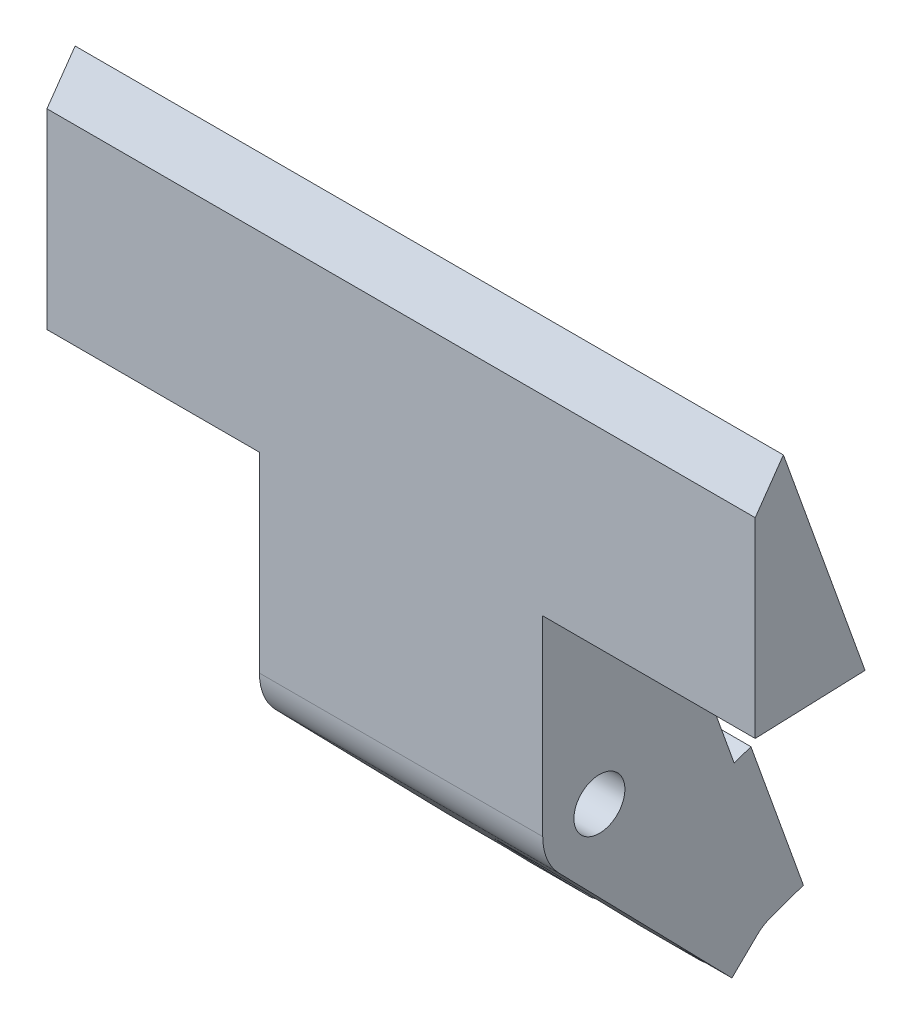
from build123d import *

# Parameters (mm, degrees)
BOSS_EXTRUDE1_DEPTH = 50.8
SCALE1_SCALE        = 0.5
SKETCH2_R           = 1.3462
CUT_EXTRUDE1_DEPTH  = 57.620860656
SKETCH3_R           = 2.286
CUT_EXTRUDE2_DEPTH  = 57.620860656
CUT_EXTRUDE3_DEPTH  = 2.286
CUT_EXTRUDE4_DEPTH  = 57.620860656
BOSS_EXTRUDE2_DEPTH = 31.75
SKETCH7_R           = 1.3462
CUT_EXTRUDE5_DEPTH  = 5.08


with BuildPart() as part:
    # Sketch1 → Boss-Extrude1 (new body)
    with BuildSketch(Plane(origin=(-34.925, 0, 0), x_dir=(0, 0, -1), z_dir=(1, 0, 0))):
        with BuildLine():
            Line((38.721808668, -36.878639896), (-2.875579258, 78.983230962))
            Line((-2.875579258, 78.983230962), (-10.16, 68.58))
            Line((-10.16, 68.58), (-10.16, 0))
            ThreePointArc((-10.16, 0), (-9.410554147, -3.829761173), (-7.27278137, -7.094522616))
            Line((-7.27278137, -7.094522616), (28.19983171, -43.458429465))
            ThreePointArc((28.19983171, -43.458429465), (36.112120939, -44.408324587), (38.721808668, -36.878639896))
        make_face()
    extrude(amount=-BOSS_EXTRUDE1_DEPTH)


with BuildPart() as part_1:
    # Scale1: scaled about (-60.325, 10.229435701, -8.69743621)
    add(part.part.scale(SCALE1_SCALE).moved(Location((-30.1625, 5.11471785, -4.348718105))))

    # Sketch2 → Cut-Extrude1 (cut, through all)
    with BuildSketch(Plane(origin=(-47.625, 0, 0), x_dir=(0, 0, -1), z_dir=(1, 0, 0))):
        with Locations((20.721378138, -14.397458564)):
            Circle(SKETCH2_R)
    extrude(amount=-CUT_EXTRUDE1_DEPTH, mode=Mode.SUBTRACT)

    # Sketch3 → Cut-Extrude2 (cut, through all)
    with BuildSketch(Plane(origin=(-47.625, 0, 0), x_dir=(0, 0, -1), z_dir=(1, 0, 0))):
        with Locations((4.348718105, 5.11471785)):
            Circle(SKETCH3_R)
    extrude(amount=-CUT_EXTRUDE2_DEPTH, mode=Mode.SUBTRACT)

    # Sketch4 → Cut-Extrude3 (cut, symmetric)
    with BuildSketch(Plane(origin=(-60.325, 0, 0), x_dir=(0, 0, -1), z_dir=(1, 0, 0))):
        with BuildLine():
            Line((9.58048069, -7.52352017), (18.44863396, -16.614496882))
            ThreePointArc((18.44863396, -16.614496882), (22.404778575, -17.089444443), (23.709622439, -13.324602098))
            Line((23.709622439, -13.324602098), (18.502250725, 1.179573745))
            Line((18.502250725, 1.179573745), (9.58048069, -7.52352017))
        make_face()
    extrude(amount=CUT_EXTRUDE3_DEPTH, both=True, mode=Mode.SUBTRACT)

    # Sketch5 → Cut-Extrude4 (cut, through all)
    with BuildSketch(Plane(origin=(-47.625, 0, 0), x_dir=(0, 0, -1), z_dir=(1, 0, 0))):
        Polygon((1.795924155, 43.013942134), (16.43679686, 2.234484886), (17.930919011, 2.770913119), (2.910928476, 44.606333332), align=None)
    extrude(amount=-CUT_EXTRUDE4_DEPTH, mode=Mode.SUBTRACT)

    # Sketch6 → Boss-Extrude2 (add, symmetric)
    with BuildSketch(Plane(origin=(-60.325, 0, 0), x_dir=(0, 0, -1), z_dir=(1, 0, 0))):
        Polygon((-0.731281895, 22.25971785), (-0.731281895, 39.40471785), (1.795924155, 43.013942134), (9.116360508, 22.62421351), align=None)
    extrude(amount=BOSS_EXTRUDE2_DEPTH, both=True)

    # Sketch7 → Cut-Extrude5 (cut)
    # profile 1 of 3: a face of its own
    with BuildSketch(Plane(origin=(-47.625, 0, 0), x_dir=(0, 0, -1), z_dir=(1, 0, 0))):
        with BuildLine():
            ThreePointArc((23.709622439, -13.324602098), (22.075761864, -11.525826672), (19.648521671, -11.409214263))
            ThreePointArc((19.648521671, -11.409214263), (19.037977702, -11.705472686), (18.504339821, -12.124714386))
            ThreePointArc((18.504339821, -12.124714386), (17.546622489, -14.358068573), (18.44863396, -16.614496882))
            ThreePointArc((18.44863396, -16.614496882), (21.918178505, -17.338256735), (23.896378138, -14.397458564))
            ThreePointArc((23.896378138, -14.397458564), (23.849340786, -13.852963686), (23.709622439, -13.324602098))
        make_face()
        with Locations((20.721378138, -14.397458564)):
            Circle(SKETCH7_R, mode=Mode.SUBTRACT)
    # profile 2 of 3: a face of its own
    with BuildSketch(Plane(origin=(-47.625, 0, 0), x_dir=(0, 0, -1), z_dir=(1, 0, 0))):
        with BuildLine():
            ThreePointArc((18.44863396, -16.614496882), (17.546622489, -14.358068573), (18.504339821, -12.124714386))
            Line((18.504339821, -12.124714386), (16.231595643, -14.341752704))
            Line((16.231595643, -14.341752704), (18.44863396, -16.614496882))
        make_face()
    # profile 3 of 3: a face of its own
    with BuildSketch(Plane(origin=(-47.625, 0, 0), x_dir=(0, 0, -1), z_dir=(1, 0, 0))):
        with BuildLine():
            Line((22.636765972, -10.336357797), (19.648521671, -11.409214263))
            ThreePointArc((19.648521671, -11.409214263), (22.075761864, -11.525826672), (23.709622439, -13.324602098))
            Line((23.709622439, -13.324602098), (22.636765972, -10.336357797))
        make_face()
    cut_extrude5 = extrude(amount=-CUT_EXTRUDE5_DEPTH, mode=Mode.SUBTRACT)

    # Mirror1: Cut-Extrude5 across plane
    add(cut_extrude5.mirror(Plane(origin=(-60.325, 0, 0), x_dir=(0, 0, 1), z_dir=(1, 0, 0))), mode=Mode.SUBTRACT)


solid = part_1.part
